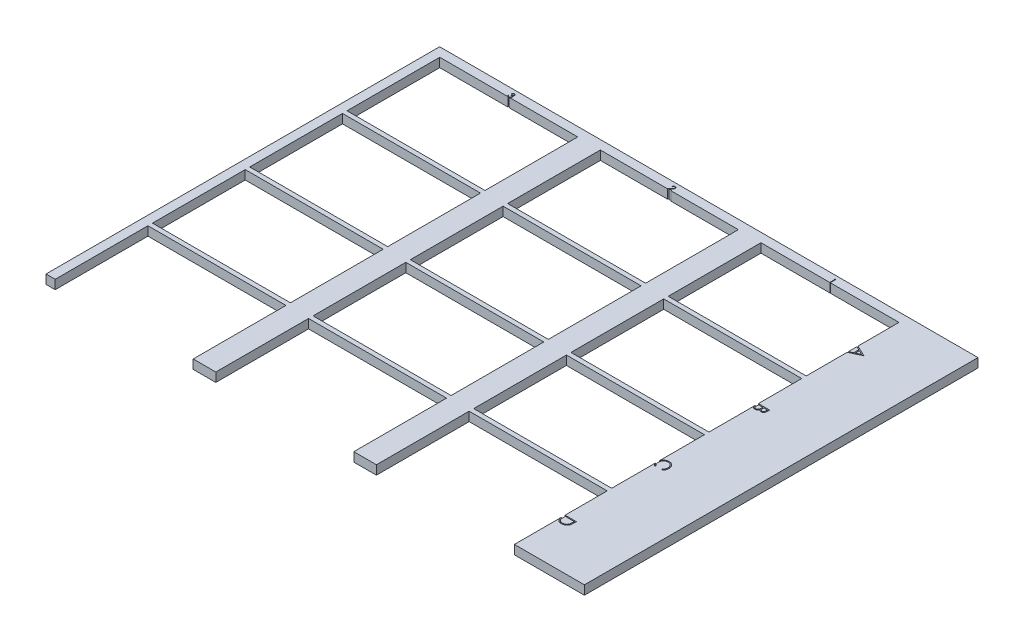
from build123d import *

# Parameters (mm, degrees)
SKETCH1_W           = 77.47
SKETCH1_H           = 52.07
BOSS_EXTRUDE4_DEPTH = 5.08
CUT_EXTRUDE9_DEPTH  = 5.08


with BuildPart() as part:
    # Sketch1 → Boss-Extrude4 (new body)
    with BuildSketch(Plane(origin=(0, 0, 0), x_dir=(1, 0, 0), z_dir=(0, 1, 0))):
        Polygon((-151.207591036, -110.49), (-146.05, -110.49), (-146.05, -58.42), (-68.58, -58.42), (-68.58, -110.49), (-55.88, -110.49), (-55.88, -58.42), (21.59, -58.42), (21.59, -110.49), (34.29, -110.49), (34.29, -58.42), (111.76, -58.42), (111.76, -110.49), (151.052408964, -110.49), (151.052408964, 110.49), (-151.207591036, 110.49), align=None)
        with Locations((-107.315, -29.845)):
            Rectangle(SKETCH1_W, SKETCH1_H, mode=Mode.SUBTRACT)
        with Locations((-17.145, -29.845)):
            Rectangle(SKETCH1_W, SKETCH1_H, mode=Mode.SUBTRACT)
        with Locations((73.025, -29.845)):
            Rectangle(SKETCH1_W, SKETCH1_H, mode=Mode.SUBTRACT)
        with Locations((-107.315, 24.765)):
            Rectangle(SKETCH1_W, SKETCH1_H, mode=Mode.SUBTRACT)
        with Locations((-17.145, 24.765)):
            Rectangle(SKETCH1_W, SKETCH1_H, mode=Mode.SUBTRACT)
        with Locations((-107.315, 79.375)):
            Rectangle(SKETCH1_W, SKETCH1_H, mode=Mode.SUBTRACT)
        with Locations((-17.145, 79.375)):
            Rectangle(SKETCH1_W, SKETCH1_H, mode=Mode.SUBTRACT)
        with Locations((73.025, 24.765)):
            Rectangle(SKETCH1_W, SKETCH1_H, mode=Mode.SUBTRACT)
        with Locations((73.025, 79.375)):
            Rectangle(SKETCH1_W, SKETCH1_H, mode=Mode.SUBTRACT)
    extrude(amount=BOSS_EXTRUDE4_DEPTH)

    # Sketch8 → Cut-Extrude9 (cut)
    # profile 1 of 7: a face of its own
    with BuildSketch(Plane(origin=(0, 5.08, 0), x_dir=(1, 0, 0), z_dir=(0, 1, 0))):
        Polygon((118.11, 79.293589744), (111.76, 76.362820513), (111.76, 76.982301683), (113.79525641, 77.921063702), (113.79525641, 80.799679487), (111.76, 81.765154247), (111.76, 82.387179487), (118.11, 79.375), align=None)
        Polygon((116.872309696, 79.340655048), (114.446538462, 80.49057492), (114.446538462, 78.221264022), align=None, mode=Mode.SUBTRACT)
    # profile 2 of 7: a face of its own
    with BuildSketch(Plane(origin=(0, 5.08, 0), x_dir=(1, 0, 0), z_dir=(0, 1, 0))):
        with BuildLine():
            Line((118.11, 26.474615385), (118.11, 25.235653045))
            add(Edge.make_bspline(
                [(118.11, 25.235653045), (118.109681139, 25.175004234), (118.109063106, 25.057451746), (118.099477996, 24.886510758), (118.086408481, 24.726402202), (118.065671027, 24.577079644), (118.040648803, 24.438612083), (118.010346937, 24.310582227), (117.974012938, 24.193397201), (117.916234684, 24.053492664), (117.830376936, 23.893979465), (117.703506539, 23.721262382), (117.548326213, 23.573571833), (117.37327911, 23.4462338), (117.180718496, 23.344994626), (116.975233967, 23.271753187), (116.75947595, 23.225383899), (116.611351899, 23.220615168), (116.536492388, 23.218205128)],
                knots=[0, 0, 0, 0, 1.001505555, 1.941167018, 2.826882275, 3.653841531, 4.429895133, 5.150066043, 5.825578002, 6.45369114, 7.647487171, 8.808567382, 9.977351308, 11.170798116, 12.373658725, 13.556498008, 14.765093433, 16, 16, 16, 16], degree=3))
            add(Edge.make_bspline(
                [(116.536492388, 23.218205128), (116.466353726, 23.220150205), (116.328524642, 23.223972465), (116.12725909, 23.261767034), (115.934882118, 23.318037757), (115.753765338, 23.399726219), (115.586236491, 23.504802861), (115.433291194, 23.631250472), (115.29863595, 23.781802882), (115.223670167, 23.894781468), (115.185590946, 23.952169471)],
                knots=[0, 0, 0, 0, 1.044266239, 2.052081639, 3.041743201, 4.026043445, 5.00270663, 5.980942822, 6.97441044, 8, 8, 8, 8], degree=3))
            add(Edge.make_bspline(
                [(115.185590946, 23.952169471), (115.157917248, 23.880020614), (115.10497061, 23.741981978), (115.010852235, 23.551885993), (114.90963819, 23.387448746), (114.798522364, 23.248489243), (114.677253559, 23.131437365), (114.548260115, 23.026322349), (114.405191505, 22.938259533), (114.252121508, 22.862606152), (114.090124446, 22.803067733), (113.919941192, 22.760940396), (113.743474705, 22.735055197), (113.623194862, 22.731525492), (113.562473958, 22.72974359)],
                knots=[0, 0, 0, 0, 1.272302504, 2.434229863, 3.488457646, 4.447234501, 5.35599188, 6.26022912, 7.18267843, 8.11661068, 9.06895546, 10.019249207, 11.000057067, 12, 12, 12, 12], degree=3))
            add(Edge.make_bspline(
                [(113.562473958, 22.72974359), (113.500485842, 22.731516424), (113.378522486, 22.735004524), (113.199347436, 22.7607231), (113.028142769, 22.804311677), (112.863691196, 22.864204763), (112.70692357, 22.942816916), (112.555876508, 23.036423505), (112.414573802, 23.150354586), (112.279655118, 23.277346904), (112.158418428, 23.421179366), (112.05048411, 23.576340817), (111.961311987, 23.745062992), (111.887341532, 23.924729456), (111.830014808, 24.116534097), (111.790215937, 24.31976575), (111.763336967, 24.53446858), (111.761131196, 24.681807332), (111.76, 24.757367788)],
                knots=[0, 0, 0, 0, 0.978404568, 1.925038397, 2.85041836, 3.763147166, 4.682162379, 5.614488577, 6.562659439, 7.54271123, 8.535210642, 9.526693784, 10.520907202, 11.541451354, 12.589717429, 13.675358278, 14.807842563, 16, 16, 16, 16], degree=3))
            Line((111.76, 24.757367788), (111.76, 26.474615385))
            Line((111.76, 26.474615385), (118.11, 26.474615385))
        make_face()
        with BuildLine():
            Line((117.458717949, 25.90474359), (115.423461538, 25.90474359))
            Line((115.423461538, 25.90474359), (115.423461538, 25.521860978))
            add(Edge.make_bspline(
                [(115.423461538, 25.521860978), (115.424181075, 25.465891945), (115.425571367, 25.357748368), (115.429679415, 25.200723225), (115.440678409, 25.055331233), (115.452311659, 24.921071395), (115.470224485, 24.798843581), (115.49214475, 24.688238604), (115.515124768, 24.588262886), (115.554315522, 24.473021329), (115.611648095, 24.342338932), (115.702715767, 24.203911992), (115.808237502, 24.079896012), (115.932241327, 23.976344233), (116.067626032, 23.890895914), (116.214403686, 23.833871415), (116.366844139, 23.793424687), (116.471770578, 23.789877771), (116.525044071, 23.788076923)],
                knots=[0, 0, 0, 0, 1.156481963, 2.23455883, 3.244418989, 4.168404366, 5.01828131, 5.794834307, 6.498111525, 7.13526334, 8.307595709, 9.435046769, 10.546766856, 11.659452936, 12.760769924, 13.837671619, 14.902137667, 16, 16, 16, 16], degree=3))
            add(Edge.make_bspline(
                [(116.525044071, 23.788076923), (116.56030457, 23.788977603), (116.629471889, 23.790744385), (116.729913527, 23.8068242), (116.82558773, 23.830156168), (116.914294057, 23.866607821), (116.998553798, 23.910685404), (117.074624411, 23.96802234), (117.1466735, 24.032775181), (117.212055599, 24.108821091), (117.270638216, 24.195791849), (117.322185781, 24.294516129), (117.362847974, 24.406172748), (117.399324126, 24.528230019), (117.4246346, 24.66264136), (117.445797527, 24.808093389), (117.456555228, 24.965820019), (117.457980962, 25.074940101), (117.458717949, 25.131346154)],
                knots=[0, 0, 0, 0, 0.911752476, 1.788502045, 2.626783689, 3.45400582, 4.26402138, 5.080402872, 5.911472738, 6.767166405, 7.66795952, 8.620018292, 9.640966946, 10.73819047, 11.913090943, 13.176185384, 14.540321519, 16, 16, 16, 16], degree=3))
            Line((117.458717949, 25.131346154), (117.458717949, 25.90474359))
        make_face(mode=Mode.SUBTRACT)
        with BuildLine():
            Line((114.772179487, 25.90474359), (112.411282051, 25.90474359))
            Line((112.411282051, 25.90474359), (112.411282051, 25.093185096))
            add(Edge.make_bspline(
                [(112.411282051, 25.093185096), (112.411975847, 25.035093328), (112.413313047, 24.923129104), (112.417726104, 24.761477849), (112.427553327, 24.612056238), (112.443574322, 24.47477829), (112.460221531, 24.348435585), (112.483262073, 24.23428334), (112.509456384, 24.132146551), (112.549993321, 24.013731405), (112.612860676, 23.880302727), (112.708268617, 23.736613475), (112.820435778, 23.607586425), (112.95189156, 23.499274679), (113.093745082, 23.409835086), (113.245254404, 23.347105881), (113.401797428, 23.306771901), (113.508807295, 23.302005692), (113.562473958, 23.299615385)],
                knots=[0, 0, 0, 0, 1.159821618, 2.235403267, 3.228114831, 4.14795534, 4.994323282, 5.771256229, 6.471395042, 7.097801288, 8.267864287, 9.404187171, 10.531774336, 11.667624178, 12.792825787, 13.866573821, 14.930062559, 16, 16, 16, 16], degree=3))
            add(Edge.make_bspline(
                [(113.562473958, 23.299615385), (113.596030503, 23.300103956), (113.662602321, 23.301073218), (113.760357737, 23.31624054), (113.855472736, 23.337399943), (113.946509043, 23.368040578), (114.034948011, 23.406675936), (114.119249173, 23.455161844), (114.2014282, 23.511153881), (114.305201688, 23.598743929), (114.42480707, 23.726024945), (114.541892162, 23.906931894), (114.636322991, 24.112618706), (114.676417579, 24.261803289), (114.697129407, 24.338868189)],
                knots=[0, 0, 0, 0, 0.723503378, 1.435336582, 2.130201219, 2.824764462, 3.504949994, 4.209866579, 4.920640069, 5.648298893, 7.13757748, 8.670694625, 10.280166878, 12, 12, 12, 12], degree=3))
            add(Edge.make_bspline(
                [(114.697129407, 24.338868189), (114.703398338, 24.369763806), (114.716990673, 24.436751875), (114.731329404, 24.545986183), (114.744191712, 24.671110852), (114.753456167, 24.811591078), (114.763401398, 24.967985569), (114.767131466, 25.140244081), (114.771684212, 25.328488394), (114.772010172, 25.459103286), (114.772179487, 25.526949119)],
                knots=[0, 0, 0, 0, 0.634452549, 1.375623993, 2.216454381, 3.166361212, 4.209414599, 5.370755378, 6.634280627, 8, 8, 8, 8], degree=3))
            Line((114.772179487, 25.526949119), (114.772179487, 25.90474359))
        make_face(mode=Mode.SUBTRACT)
    # profile 3 of 7: a face of its own
    with BuildSketch(Plane(origin=(0, 5.08, 0), x_dir=(1, 0, 0), z_dir=(0, 1, 0))):
        with BuildLine():
            Line((116.944815705, -32.938589744), (116.563205128, -32.439951923))
            add(Edge.make_bspline(
                [(116.563205128, -32.439951923), (116.605597673, -32.40438124), (116.689811221, -32.333719444), (116.808065537, -32.220037748), (116.918855368, -32.10156191), (117.022708493, -31.978337218), (117.115993196, -31.848145673), (117.203570769, -31.714141081), (117.282070808, -31.574081771), (117.377253654, -31.380403623), (117.476578821, -31.127042527), (117.559860398, -30.808100462), (117.612875959, -30.475158898), (117.618617886, -30.248014681), (117.621538462, -30.132479968)],
                knots=[0, 0, 0, 0, 0.757959112, 1.505699292, 2.245454638, 2.979532153, 3.711538275, 4.438200793, 5.171680507, 5.909471876, 7.393775596, 8.890124382, 10.418191784, 12, 12, 12, 12], degree=3))
            add(Edge.make_bspline(
                [(117.621538462, -30.132479968), (117.620802251, -30.068829613), (117.619336663, -29.942119638), (117.600137483, -29.754060275), (117.572842033, -29.56915638), (117.533326202, -29.388095544), (117.481880175, -29.211237272), (117.421547717, -29.037234935), (117.346470096, -28.868137816), (117.263556886, -28.701910874), (117.169880198, -28.542661658), (117.067735433, -28.391952614), (116.958125128, -28.250472259), (116.84133222, -28.117828549), (116.715905207, -27.995476207), (116.58331959, -27.881454356), (116.441979536, -27.777817938), (116.294535759, -27.682020268), (116.140771545, -27.596777475), (115.9816542, -27.523166197), (115.817792087, -27.46007521), (115.648849522, -27.409690045), (115.475491338, -27.369948117), (115.297349628, -27.342492588), (115.114770175, -27.323466123), (114.991019157, -27.322014016), (114.928639824, -27.321282051)],
                knots=[0, 0, 0, 0, 1.055000685, 2.100209969, 3.131349012, 4.153242145, 5.170189196, 6.184191144, 7.204341339, 8.235672124, 9.263040994, 10.265373269, 11.252624173, 12.22887325, 13.193405896, 14.155809299, 15.126090485, 16.097288279, 17.069732292, 18.038585918, 19.002221264, 19.978698174, 20.959418239, 21.948869816, 22.966084182, 24, 24, 24, 24], degree=3))
            add(Edge.make_bspline(
                [(114.928639824, -27.321282051), (114.834784429, -27.323571352), (114.650511811, -27.328066089), (114.380599417, -27.368068066), (114.122026195, -27.428855875), (113.876408481, -27.519961279), (113.640717603, -27.632300128), (113.418941397, -27.774250951), (113.207728487, -27.938655241), (113.012070568, -28.12783883), (112.833338524, -28.335403668), (112.675948183, -28.55810345), (112.544748325, -28.795383515), (112.435571964, -29.044623973), (112.351649044, -29.307742779), (112.29256842, -29.584266778), (112.254029036, -29.873594541), (112.250339344, -30.071296166), (112.248461538, -30.171913061)],
                knots=[0, 0, 0, 0, 1.029171465, 2.020641659, 2.987623507, 3.938342917, 4.889210282, 5.84687017, 6.821220943, 7.821438502, 8.827599549, 9.822697543, 10.807740252, 11.797342354, 12.80366471, 13.83203677, 14.896651826, 16, 16, 16, 16], degree=3))
            add(Edge.make_bspline(
                [(112.248461538, -30.171913061), (112.251525467, -30.282770797), (112.257556013, -30.50096534), (112.308644936, -30.820947331), (112.391481444, -31.127263648), (112.507410532, -31.41993077), (112.658114697, -31.698123628), (112.840809417, -31.962277569), (113.057232535, -32.212615561), (113.222483354, -32.363149173), (113.306794872, -32.439951923)],
                knots=[0, 0, 0, 0, 1.028121516, 2.023589091, 2.998037872, 3.967518031, 4.937445131, 5.927275754, 6.942489185, 8, 8, 8, 8], degree=3))
            Line((113.306794872, -32.439951923), (112.929000401, -32.938589744))
            add(Edge.make_bspline(
                [(112.929000401, -32.938589744), (112.877223407, -32.898461226), (112.773917427, -32.818396404), (112.628282924, -32.688750355), (112.491292127, -32.552178781), (112.36407883, -32.407649584), (112.243987323, -32.256891333), (112.135043577, -32.097248498), (112.033928993, -31.93147842), (111.942568033, -31.758615962), (111.860652906, -31.579228654), (111.791497891, -31.393503181), (111.731069307, -31.20301302), (111.681684053, -31.007662239), (111.643076564, -30.806798224), (111.617282312, -30.601110145), (111.599606535, -30.390163816), (111.597995761, -30.247848605), (111.597179487, -30.175729167)],
                knots=[0, 0, 0, 0, 0.986756325, 1.968786143, 2.935506311, 3.899499537, 4.868307269, 5.8376204, 6.809456583, 7.792545619, 8.781780509, 9.778496008, 10.776623214, 11.79151764, 12.812666265, 13.856269958, 14.913646641, 16, 16, 16, 16], degree=3))
            add(Edge.make_bspline(
                [(111.597179487, -30.175729167), (111.597654817, -30.107432799), (111.598594721, -29.97238519), (111.613820511, -29.772997455), (111.634593605, -29.578887787), (111.665872129, -29.390610966), (111.702782574, -29.207139554), (111.752260425, -29.030136779), (111.807685342, -28.857860898), (111.872827246, -28.691004051), (111.946335178, -28.52942431), (112.029414149, -28.373642823), (112.121365532, -28.223731239), (112.220162479, -28.07821569), (112.328978441, -27.939245788), (112.446302192, -27.805617249), (112.571738298, -27.676580756), (112.662189246, -27.596747314), (112.707666266, -27.556608574)],
                knots=[0, 0, 0, 0, 1.114604814, 2.203992996, 3.262667896, 4.300477797, 5.318619304, 6.316056647, 7.298880507, 8.271930387, 9.238335007, 10.195173496, 11.151986948, 12.108099108, 13.064862484, 14.031167946, 15.010108607, 16, 16, 16, 16], degree=3))
            add(Edge.make_bspline(
                [(112.707666266, -27.556608574), (112.786662423, -27.492318192), (112.943701026, -27.364513598), (113.198219878, -27.200999858), (113.463955057, -27.061032151), (113.742302642, -26.947864409), (114.032638045, -26.859394879), (114.335107621, -26.798106139), (114.649428887, -26.758279657), (114.86321849, -26.753725276), (114.971889022, -26.751410256)],
                knots=[0, 0, 0, 0, 0.994628077, 1.977248131, 2.950237994, 3.925870899, 4.908910175, 5.911660606, 6.938484602, 8, 8, 8, 8], degree=3))
            add(Edge.make_bspline(
                [(114.971889022, -26.751410256), (115.086103424, -26.754244442), (115.310813128, -26.759820525), (115.640671219, -26.806804203), (115.956243845, -26.883302707), (116.258745252, -26.988641657), (116.546444643, -27.127611896), (116.820557094, -27.295846609), (117.080858784, -27.494989044), (117.324021732, -27.72253816), (117.546337205, -27.97213776), (117.741930009, -28.239412742), (117.904702809, -28.523860895), (118.040767384, -28.82234304), (118.145350881, -29.137095699), (118.218563099, -29.467446937), (118.264132722, -29.812776116), (118.269893457, -30.048383659), (118.272820513, -30.168096955)],
                knots=[0, 0, 0, 0, 1.032901378, 2.032168977, 3.007206631, 3.966850309, 4.924221947, 5.891988639, 6.871730993, 7.884084801, 8.900290346, 9.89161143, 10.874607481, 11.860025555, 12.854717796, 13.869097222, 14.917278314, 16, 16, 16, 16], degree=3))
            add(Edge.make_bspline(
                [(118.272820513, -30.168096955), (118.27194643, -30.24105764), (118.270216271, -30.385475968), (118.253322795, -30.599110851), (118.225211517, -30.807112405), (118.186697164, -31.009983654), (118.139491479, -31.208460249), (118.077695589, -31.40050597), (118.005935411, -31.587166578), (117.925394904, -31.768581871), (117.833318651, -31.942778105), (117.733314188, -32.109723579), (117.623073079, -32.267404402), (117.506239897, -32.418786561), (117.378444314, -32.560461963), (117.243848093, -32.696476823), (117.098457292, -32.822132675), (116.996123317, -32.89969966), (116.944815705, -32.938589744)],
                knots=[0, 0, 0, 0, 1.096705196, 2.170817488, 3.219277236, 4.250701065, 5.274195539, 6.284202015, 7.28098643, 8.279664616, 9.266225751, 10.241373748, 11.203306326, 12.157093976, 13.114198862, 14.069774147, 15.032234603, 16, 16, 16, 16], degree=3))
        make_face()
    # profile 4 of 7: a face of its own
    with BuildSketch(Plane(origin=(0, 5.08, 0), x_dir=(1, 0, 0), z_dir=(0, 1, 0))):
        with BuildLine():
            Line((111.76, -82.012692308), (118.11, -82.012692308))
            Line((118.11, -82.012692308), (118.11, -83.294903846))
            add(Edge.make_bspline(
                [(118.11, -83.294903846), (118.10919924, -83.406426385), (118.107652175, -83.62188735), (118.097786915, -83.933238257), (118.080511466, -84.220906485), (118.054862343, -84.484728674), (118.024076207, -84.725128674), (117.984923928, -84.941721457), (117.938878197, -85.134858028), (117.899605318, -85.253638066), (117.881033654, -85.309807692)],
                knots=[0, 0, 0, 0, 1.314317071, 2.539253741, 3.67075822, 4.709970291, 5.662644612, 6.526156501, 7.303037452, 8, 8, 8, 8], degree=3))
            add(Edge.make_bspline(
                [(117.881033654, -85.309807692), (117.853037914, -85.383276673), (117.797681284, -85.528548601), (117.693258165, -85.735390771), (117.574941266, -85.930107124), (117.44258475, -86.11375686), (117.2924032, -86.282089414), (117.130916153, -86.441891296), (116.951524797, -86.585988874), (116.760320009, -86.720164865), (116.555362101, -86.837571052), (116.340810785, -86.941109671), (116.117067511, -87.029513574), (115.882503759, -87.098492965), (115.639371325, -87.15548169), (115.385829701, -87.193719768), (115.123356971, -87.219119775), (114.945238152, -87.221659883), (114.854861779, -87.222948718)],
                knots=[0, 0, 0, 0, 0.98467389, 1.947018643, 2.898343565, 3.837828625, 4.779009928, 5.722093987, 6.681368302, 7.658573986, 8.646467994, 9.637429229, 10.641859304, 11.657149908, 12.698561448, 13.768651538, 14.867827761, 16, 16, 16, 16], degree=3))
            add(Edge.make_bspline(
                [(114.854861779, -87.222948718), (114.776373797, -87.221806822), (114.621705032, -87.219556598), (114.39375275, -87.199375846), (114.172580583, -87.169987158), (113.959159893, -87.124695693), (113.752052982, -87.069043404), (113.552243376, -87.000351318), (113.359584615, -86.918944546), (113.175646042, -86.82449634), (113.000731948, -86.721221421), (112.837852299, -86.607986514), (112.683909336, -86.491289421), (112.545846691, -86.362132049), (112.415768103, -86.229414775), (112.300701958, -86.08609986), (112.195636064, -85.936856417), (112.101337325, -85.778809783), (112.019522725, -85.608171823), (111.94943361, -85.422613554), (111.891722261, -85.221141181), (111.843495333, -85.004063511), (111.805260876, -84.770955192), (111.779629867, -84.521602395), (111.762298604, -84.256383924), (111.760781079, -84.074267288), (111.76, -83.980530849)],
                knots=[0, 0, 0, 0, 1.105818345, 2.179130549, 3.222742436, 4.24813173, 5.251184997, 6.243232575, 7.223185975, 8.195898781, 9.155064964, 10.083206407, 10.990357329, 11.874224667, 12.744762365, 13.607037788, 14.46074101, 15.315384698, 16.197310979, 17.123950979, 18.107232398, 19.148086642, 20.256146639, 21.433991621, 22.679261309, 24, 24, 24, 24], degree=3))
            Line((111.76, -83.980530849), (111.76, -82.012692308))
        make_face()
        with BuildLine():
            Line((112.411282051, -82.582564103), (112.411282051, -83.311440304))
            add(Edge.make_bspline(
                [(112.411282051, -83.311440304), (112.411732169, -83.416176063), (112.41259791, -83.617621283), (112.420194693, -83.907286506), (112.432607922, -84.171953411), (112.449979849, -84.411659579), (112.472964337, -84.626269665), (112.498590946, -84.816232183), (112.53051775, -84.980924438), (112.559457347, -85.08058213), (112.572830529, -85.126634615)],
                knots=[0, 0, 0, 0, 1.375205317, 2.645023457, 3.804390687, 4.853969522, 5.800190428, 6.637939096, 7.370582563, 8, 8, 8, 8], degree=3))
            add(Edge.make_bspline(
                [(112.572830529, -85.126634615), (112.593242549, -85.184599298), (112.633579048, -85.299144178), (112.707184232, -85.464010709), (112.794265109, -85.61784952), (112.891632722, -85.763227177), (113.000795015, -85.899202305), (113.122082386, -86.02517169), (113.254153497, -86.142030641), (113.397503093, -86.248500834), (113.551204387, -86.34363756), (113.713300631, -86.426559757), (113.883400607, -86.496918019), (114.062117399, -86.554129451), (114.249282549, -86.598465023), (114.444403664, -86.63000926), (114.647541614, -86.649619319), (114.785702691, -86.651909464), (114.856133814, -86.653076923)],
                knots=[0, 0, 0, 0, 0.998463025, 1.973077781, 2.929496817, 3.867873318, 4.813809365, 5.759268434, 6.706333209, 7.676553387, 8.657505312, 9.640584699, 10.632319813, 11.645628493, 12.686877747, 13.755137172, 14.855624085, 16, 16, 16, 16], degree=3))
            add(Edge.make_bspline(
                [(114.856133814, -86.653076923), (114.930398398, -86.652144681), (115.07629183, -86.650313282), (115.290366967, -86.627332533), (115.49623045, -86.593678155), (115.694030492, -86.545268959), (115.88350975, -86.482728451), (116.065738702, -86.407893664), (116.238372234, -86.317032486), (116.402872487, -86.214168026), (116.556748208, -86.098683831), (116.698196661, -85.971092184), (116.827481331, -85.832738462), (116.94480806, -85.684260293), (117.048090353, -85.523581703), (117.139968669, -85.353421689), (117.218033951, -85.17138332), (117.259539698, -85.044720759), (117.280633013, -84.980350561)],
                knots=[0, 0, 0, 0, 1.122272916, 2.204715076, 3.251197285, 4.274229216, 5.279697671, 6.265416158, 7.248880903, 8.225321784, 9.195852973, 10.153576302, 11.101466393, 12.055578741, 13.010401466, 13.985536859, 14.976245305, 16, 16, 16, 16], degree=3))
            add(Edge.make_bspline(
                [(117.280633013, -84.980350561), (117.295358532, -84.927099195), (117.326669026, -84.813872182), (117.36082363, -84.629106297), (117.390948936, -84.421161669), (117.416454236, -84.189115068), (117.434755519, -83.933231006), (117.448492047, -83.653312687), (117.457756937, -83.349239119), (117.458389591, -83.138450807), (117.458717949, -83.029048478)],
                knots=[0, 0, 0, 0, 0.674548936, 1.434276114, 2.292660221, 3.240891867, 4.284742987, 5.42552168, 6.663806718, 8, 8, 8, 8], degree=3))
            Line((117.458717949, -83.029048478), (117.458717949, -82.582564103))
            Line((117.458717949, -82.582564103), (112.411282051, -82.582564103))
        make_face(mode=Mode.SUBTRACT)
    # profile 5 of 7: a face of its own
    with BuildSketch(Plane(origin=(0, 5.08, 0), x_dir=(1, 0, 0), z_dir=(0, 1, 0))):
        with BuildLine():
            Line((-108.006987179, 107.852307692), (-108.291923077, 107.852307692))
            add(Edge.make_bspline(
                [(-108.291923077, 107.852307692), (-108.284203699, 107.884268588), (-108.269112946, 107.946749526), (-108.23763729, 108.03601897), (-108.203347966, 108.120495307), (-108.162173564, 108.198596746), (-108.117262051, 108.271892893), (-108.065806439, 108.338721313), (-108.010180691, 108.400781646), (-107.948653773, 108.455857226), (-107.884129915, 108.50572988), (-107.815699939, 108.548252254), (-107.7447406, 108.584832021), (-107.670760258, 108.614967517), (-107.593538659, 108.637669242), (-107.513773929, 108.654140059), (-107.43125704, 108.664836284), (-107.375243154, 108.66588019), (-107.346800881, 108.666410256)],
                knots=[0, 0, 0, 0, 1.162005537, 2.271625781, 3.343758855, 4.383309926, 5.390229558, 6.379919256, 7.361854164, 8.333198761, 9.295911338, 10.242430842, 11.177959212, 12.116337295, 13.062827104, 14.020064771, 14.994644689, 16, 16, 16, 16], degree=3))
            add(Edge.make_bspline(
                [(-107.346800881, 108.666410256), (-107.305360108, 108.665159098), (-107.223382505, 108.662684071), (-107.102947456, 108.640083118), (-106.986808841, 108.604318891), (-106.876237881, 108.554903438), (-106.773532588, 108.493954947), (-106.682150476, 108.421415507), (-106.603330184, 108.338684712), (-106.53720457, 108.247305886), (-106.485429392, 108.14964696), (-106.447251039, 108.049135389), (-106.424008514, 107.9460096), (-106.420996295, 107.876379783), (-106.419487179, 107.841495393)],
                knots=[0, 0, 0, 0, 1.083050992, 2.142477498, 3.193116406, 4.255571735, 5.30263384, 6.308962982, 7.297363603, 8.282367274, 9.249857812, 10.179914175, 11.08814088, 12, 12, 12, 12], degree=3))
            add(Edge.make_bspline(
                [(-106.419487179, 107.841495393), (-106.420542723, 107.807924943), (-106.422608257, 107.742232783), (-106.44014669, 107.646328282), (-106.469661729, 107.555939116), (-106.510546442, 107.470684776), (-106.563470562, 107.391105814), (-106.627580795, 107.317023185), (-106.703329638, 107.248108306), (-106.760732674, 107.208629927), (-106.790285457, 107.188305288)],
                knots=[0, 0, 0, 0, 1.024540389, 2.004866551, 2.965041327, 3.920577974, 4.882998113, 5.874504559, 6.905732034, 8, 8, 8, 8], degree=3))
            add(Edge.make_bspline(
                [(-106.790285457, 107.188305288), (-106.756510937, 107.171996519), (-106.689593843, 107.139684128), (-106.598380149, 107.076314977), (-106.515578076, 107.003148148), (-106.469401131, 106.94605017), (-106.44619992, 106.917361779)],
                knots=[0, 0, 0, 0, 1.015518401, 2.012035669, 3.001164323, 4, 4, 4, 4], degree=3))
            add(Edge.make_bspline(
                [(-106.44619992, 106.917361779), (-106.430922416, 106.896445104), (-106.400617589, 106.85495428), (-106.363211069, 106.788246236), (-106.329275659, 106.720798814), (-106.302832245, 106.65080421), (-106.282354523, 106.57907369), (-106.267716837, 106.505484088), (-106.258623509, 106.429975311), (-106.257321258, 106.378891847), (-106.256666667, 106.353214143)],
                knots=[0, 0, 0, 0, 1.025084078, 2.033381695, 3.024893161, 4.013698104, 4.991890475, 5.976764909, 6.982997093, 8, 8, 8, 8], degree=3))
            add(Edge.make_bspline(
                [(-106.256666667, 106.353214143), (-106.258294547, 106.308755324), (-106.261542646, 106.220046911), (-106.290574914, 106.088987699), (-106.335581211, 105.960875994), (-106.399495717, 105.838343818), (-106.477389814, 105.723698758), (-106.570061101, 105.621122392), (-106.676456629, 105.532949372), (-106.795116039, 105.459280094), (-106.923673719, 105.400390265), (-107.061174435, 105.359516727), (-107.205636984, 105.332895713), (-107.304703604, 105.330041054), (-107.355069111, 105.328589744)],
                knots=[0, 0, 0, 0, 0.955779014, 1.907060117, 2.875433937, 3.871313158, 4.872415639, 5.851225146, 6.836215519, 7.83643374, 8.849228613, 9.86973379, 10.916971861, 12, 12, 12, 12], degree=3))
            add(Edge.make_bspline(
                [(-107.355069111, 105.328589744), (-107.389013762, 105.329377337), (-107.455805515, 105.330927058), (-107.553997832, 105.341521218), (-107.647725373, 105.36087058), (-107.737114866, 105.386908578), (-107.82224572, 105.419921087), (-107.902858158, 105.46103162), (-107.979448133, 105.509392769), (-108.051292896, 105.565575381), (-108.118383883, 105.628423453), (-108.17893814, 105.699052698), (-108.233965237, 105.776157486), (-108.281991774, 105.860633401), (-108.325205295, 105.951388741), (-108.36074802, 106.049585593), (-108.392031357, 106.154346099), (-108.406576, 106.227350906), (-108.414038462, 106.264807692)],
                knots=[0, 0, 0, 0, 1.048658725, 2.063410685, 3.046034179, 4.001477787, 4.936774919, 5.862367409, 6.792675028, 7.730719943, 8.675894397, 9.627829632, 10.600096036, 11.597688215, 12.626045268, 13.701542398, 14.82072376, 16, 16, 16, 16], degree=3))
            Line((-108.414038462, 106.264807692), (-108.129102564, 106.264807692))
            add(Edge.make_bspline(
                [(-108.129102564, 106.264807692), (-108.12167915, 106.240361087), (-108.107239964, 106.192810317), (-108.082661565, 106.124375183), (-108.054659633, 106.061638949), (-108.024619997, 106.004141403), (-107.993070978, 105.951316295), (-107.957769582, 105.904560456), (-107.921330429, 105.861820237), (-107.89386273, 105.837740482), (-107.880419671, 105.825955529)],
                knots=[0, 0, 0, 0, 1.198163088, 2.33053128, 3.407730985, 4.417276592, 5.372219308, 6.28897303, 7.162600585, 8, 8, 8, 8], degree=3))
            add(Edge.make_bspline(
                [(-107.880419671, 105.825955529), (-107.862642777, 105.812250112), (-107.827143861, 105.784881583), (-107.769296966, 105.749955106), (-107.708459534, 105.71969189), (-107.643313365, 105.696574537), (-107.575264252, 105.677000516), (-107.503212285, 105.664191188), (-107.427793138, 105.655402633), (-107.376296667, 105.654627088), (-107.34998097, 105.654230769)],
                knots=[0, 0, 0, 0, 0.946170439, 1.889420265, 2.845303464, 3.807233317, 4.801018734, 5.828864929, 6.890507805, 8, 8, 8, 8], degree=3))
            add(Edge.make_bspline(
                [(-107.34998097, 105.654230769), (-107.320268864, 105.654789483), (-107.262169405, 105.655882), (-107.177392497, 105.665929249), (-107.096740741, 105.680561838), (-107.021109587, 105.703161472), (-106.949508341, 105.731084102), (-106.882940702, 105.766143727), (-106.820532806, 105.807277867), (-106.763083988, 105.854031247), (-106.711426277, 105.905213603), (-106.665942576, 105.958746889), (-106.627275919, 106.014405392), (-106.596085101, 106.072497116), (-106.571455674, 106.132781502), (-106.55468877, 106.195427726), (-106.54303061, 106.259923103), (-106.542081183, 106.303764382), (-106.541602564, 106.325865385)],
                knots=[0, 0, 0, 0, 1.217147791, 2.380027433, 3.494444702, 4.572153297, 5.609568379, 6.639424714, 7.649109417, 8.668170816, 9.669597737, 10.625200337, 11.543417969, 12.441394052, 13.322311151, 14.205496177, 15.095365482, 16, 16, 16, 16], degree=3))
            add(Edge.make_bspline(
                [(-106.541602564, 106.325865385), (-106.542990766, 106.355448528), (-106.545760263, 106.414467612), (-106.566904474, 106.501297126), (-106.601683301, 106.584956936), (-106.650371936, 106.664019688), (-106.709640776, 106.737294971), (-106.778914656, 106.802674101), (-106.858768834, 106.856621969), (-106.93226543, 106.893895251), (-106.997366679, 106.919328883), (-107.053079206, 106.936269744), (-107.115451268, 106.950614988), (-107.183728599, 106.96396112), (-107.258425659, 106.975319772), (-107.339461128, 106.984791991), (-107.426851426, 106.992371206), (-107.487349841, 106.995755843), (-107.518525641, 106.9975)],
                knots=[0, 0, 0, 0, 1.07054697, 2.135767047, 3.216561865, 4.33974944, 5.486079747, 6.621378074, 7.775625952, 8.963672916, 9.598146892, 10.304877434, 11.070270905, 11.915000392, 12.823868403, 13.805723172, 14.86925407, 16, 16, 16, 16], degree=3))
            Line((-107.518525641, 106.9975), (-107.518525641, 107.323141026))
            add(Edge.make_bspline(
                [(-107.518525641, 107.323141026), (-107.479245298, 107.323807598), (-107.402304755, 107.325113248), (-107.289914921, 107.340904801), (-107.182442702, 107.36274937), (-107.082269872, 107.396209509), (-106.990967111, 107.435071778), (-106.911755757, 107.480294854), (-106.84574556, 107.530563948), (-106.793257302, 107.586654958), (-106.753770073, 107.64681218), (-106.724898621, 107.709510862), (-106.707844039, 107.775300546), (-106.705567413, 107.82019928), (-106.704423077, 107.842767428)],
                knots=[0, 0, 0, 0, 1.321986639, 2.589447074, 3.816329219, 5.01088745, 6.139805852, 7.153945165, 8.075214402, 8.924034688, 9.728124013, 10.488707548, 11.240355623, 12, 12, 12, 12], degree=3))
            add(Edge.make_bspline(
                [(-106.704423077, 107.842767428), (-106.704799007, 107.859347954), (-106.705546902, 107.892334124), (-106.714978718, 107.94052615), (-106.729151955, 107.987244866), (-106.748637138, 108.032291594), (-106.774717676, 108.075353913), (-106.80592882, 108.116798956), (-106.84309274, 108.156390099), (-106.885678967, 108.19329296), (-106.931409676, 108.228462197), (-106.981529114, 108.258319567), (-107.034526101, 108.283851159), (-107.090459309, 108.304905493), (-107.149510255, 108.320743562), (-107.211401489, 108.332115361), (-107.27625103, 108.339225234), (-107.320493959, 108.340248868), (-107.342984776, 108.340769231)],
                knots=[0, 0, 0, 0, 0.884392785, 1.759457502, 2.611959086, 3.489218968, 4.37281399, 5.2945488, 6.255912374, 7.266815255, 8.301784654, 9.332968512, 10.37626691, 11.440494194, 12.520033166, 13.637162961, 14.798855837, 16, 16, 16, 16], degree=3))
            add(Edge.make_bspline(
                [(-107.342984776, 108.340769231), (-107.379135932, 108.339507067), (-107.449747547, 108.337041767), (-107.551542508, 108.315449033), (-107.646175046, 108.280997486), (-107.718509408, 108.239873961), (-107.771924315, 108.199278925), (-107.810094109, 108.163825617), (-107.847577715, 108.124425841), (-107.88190915, 108.078652887), (-107.916629115, 108.029606584), (-107.94823811, 107.974793673), (-107.978953688, 107.915643972), (-107.997461715, 107.873828647), (-108.006987179, 107.852307692)],
                knots=[0, 0, 0, 0, 1.472543308, 2.876219568, 4.221790263, 5.565193594, 6.249813518, 6.953379497, 7.687249741, 8.463570142, 9.283606569, 10.136032583, 11.040678096, 12, 12, 12, 12], degree=3))
        make_face()
    # profile 6 of 7: a face of its own
    with BuildSketch(Plane(origin=(0, 5.08, 0), x_dir=(1, 0, 0), z_dir=(0, 1, 0))):
        with BuildLine():
            Line((-17.836987179, 107.608076923), (-18.121923077, 107.608076923))
            add(Edge.make_bspline(
                [(-18.121923077, 107.608076923), (-18.120066017, 107.645878371), (-18.1164188, 107.720119409), (-18.099338852, 107.828363239), (-18.074899627, 107.931827235), (-18.040345237, 108.029680657), (-17.997431685, 108.122788718), (-17.945969446, 108.210781589), (-17.885015024, 108.293323596), (-17.81588463, 108.369649547), (-17.74080165, 108.4396697), (-17.659788405, 108.500135528), (-17.574657559, 108.551223701), (-17.48566739, 108.593933113), (-17.391813879, 108.625991402), (-17.293948715, 108.649778175), (-17.191641927, 108.664089574), (-17.12193705, 108.665627894), (-17.086486378, 108.666410256)],
                knots=[0, 0, 0, 0, 1.10065271, 2.161652631, 3.183658789, 4.190468796, 5.17591951, 6.163126047, 7.15150782, 8.156236427, 9.156009102, 10.134482811, 11.092018607, 12.041330605, 13.001268258, 13.972401359, 14.968799086, 16, 16, 16, 16], degree=3))
            add(Edge.make_bspline(
                [(-17.086486378, 108.666410256), (-17.051671982, 108.665595228), (-16.983262938, 108.663993726), (-16.883420968, 108.650240507), (-16.788372994, 108.628699863), (-16.698304806, 108.598478021), (-16.613935018, 108.557852148), (-16.534629828, 108.509050095), (-16.459445093, 108.452607819), (-16.391766082, 108.386156146), (-16.329619467, 108.315215411), (-16.276005278, 108.239479956), (-16.230091909, 108.161257675), (-16.191821656, 108.079952092), (-16.163649302, 107.994797659), (-16.142260499, 107.907034125), (-16.13017063, 107.815753047), (-16.128315139, 107.753970671), (-16.127371795, 107.722560096)],
                knots=[0, 0, 0, 0, 1.111607364, 2.184268762, 3.212621178, 4.221274766, 5.211760367, 6.196651075, 7.1921475, 8.207485113, 9.220403448, 10.201281604, 11.166441695, 12.114753415, 13.065576456, 14.026450734, 14.996634279, 16, 16, 16, 16], degree=3))
            add(Edge.make_bspline(
                [(-16.127371795, 107.722560096), (-16.128907826, 107.678338846), (-16.131952934, 107.590672367), (-16.158000975, 107.461844598), (-16.198683167, 107.337027711), (-16.247666484, 107.236573158), (-16.297080773, 107.155625632), (-16.341610154, 107.088979021), (-16.393738947, 107.01721906), (-16.45422587, 106.940586047), (-16.52181969, 106.858479726), (-16.597132653, 106.770949697), (-16.680701811, 106.678900306), (-16.739356308, 106.616030225), (-16.769749599, 106.583452524)],
                knots=[0, 0, 0, 0, 1.184426356, 2.348067706, 3.509069118, 4.696110526, 5.333549288, 6.050745305, 6.844228056, 7.710549037, 8.667450064, 9.695053472, 10.805634456, 12, 12, 12, 12], degree=3))
            Line((-16.769749599, 106.583452524), (-17.564135617, 105.735641026))
            Line((-17.564135617, 105.735641026), (-16.086666667, 105.735641026))
            Line((-16.086666667, 105.735641026), (-16.086666667, 105.41))
            Line((-16.086666667, 105.41), (-18.244038462, 105.41))
            Line((-18.244038462, 105.41), (-17.012708333, 106.72401242))
            add(Edge.make_bspline(
                [(-17.012708333, 106.72401242), (-16.982729179, 106.755307312), (-16.925145359, 106.815418396), (-16.843699735, 106.903178081), (-16.770548653, 106.984593736), (-16.70521859, 107.059511533), (-16.649126767, 107.129027313), (-16.599349814, 107.190889651), (-16.559466742, 107.247816902), (-16.516182061, 107.313803031), (-16.474259378, 107.39436849), (-16.438234598, 107.492824051), (-16.416268271, 107.59417663), (-16.413633171, 107.662667764), (-16.412307692, 107.697119391)],
                knots=[0, 0, 0, 0, 1.329631726, 2.553950428, 3.673215718, 4.687767853, 5.603093632, 6.413772471, 7.123043292, 7.734684054, 8.834405432, 9.900288307, 10.943827018, 12, 12, 12, 12], degree=3))
            add(Edge.make_bspline(
                [(-16.412307692, 107.697119391), (-16.412884401, 107.718783231), (-16.414020984, 107.7614785), (-16.424051896, 107.824076581), (-16.439210712, 107.884460376), (-16.460932482, 107.942815624), (-16.48960431, 107.998555608), (-16.524505162, 108.051748179), (-16.564773291, 108.103173169), (-16.611356228, 108.151390804), (-16.662529535, 108.195551612), (-16.716590033, 108.234671318), (-16.773785485, 108.26736394), (-16.833874739, 108.294164112), (-16.896690271, 108.315187494), (-16.962353576, 108.329754919), (-17.030683219, 108.338901173), (-17.077340748, 108.340138671), (-17.101114784, 108.340769231)],
                knots=[0, 0, 0, 0, 0.991446411, 1.95395049, 2.89581595, 3.838931463, 4.798493298, 5.75982156, 6.748411868, 7.785213223, 8.824556874, 9.840280684, 10.836137867, 11.835679398, 12.848801643, 13.863922112, 14.911575587, 16, 16, 16, 16], degree=3))
            add(Edge.make_bspline(
                [(-17.101114784, 108.340769231), (-17.125944039, 108.340120594), (-17.174704597, 108.33884678), (-17.246295434, 108.32993622), (-17.314590389, 108.314563922), (-17.379761259, 108.293539367), (-17.441918311, 108.266816255), (-17.500759266, 108.233531601), (-17.556152029, 108.193813718), (-17.608200733, 108.148782642), (-17.656155914, 108.098647032), (-17.698289865, 108.042757994), (-17.735105364, 107.982135982), (-17.767226597, 107.916944568), (-17.793312116, 107.846592211), (-17.813244903, 107.77132865), (-17.829017256, 107.691480682), (-17.834286414, 107.636339927), (-17.836987179, 107.608076923)],
                knots=[0, 0, 0, 0, 1.031018746, 2.02475058, 2.990194455, 3.934040569, 4.864654155, 5.795059489, 6.735614925, 7.690564532, 8.649604399, 9.611025574, 10.590972636, 11.591080095, 12.624614302, 13.701020113, 14.821632451, 16, 16, 16, 16], degree=3))
        make_face()
    # profile 7 of 7: a face of its own
    with BuildSketch(Plane(origin=(0, 5.08, 0), x_dir=(1, 0, 0), z_dir=(0, 1, 0))):
        Polygon((72.600776242, 108.585), (73.187820513, 108.585), (73.187820513, 105.41), (72.902884615, 105.41), (72.902884615, 108.259358974), (72.414423077, 108.259358974), align=None)
    extrude(amount=-CUT_EXTRUDE9_DEPTH, mode=Mode.SUBTRACT)


with BuildPart() as cut_extrude9_piece_1:
    # of the separate pieces the step leaves, piece 1, a body of its own (cut_extrude9_pieces)
    add(part.part.solids().sort_by_distance((151.052408964, 0, -110.49))[0])


with BuildPart() as cut_extrude9_piece_2:
    # of the separate pieces the step leaves, piece 2, a body of its own (cut_extrude9_pieces)
    add(part.part.solids().sort_by_distance((117.458717949, 0, 82.582564103))[0])


with BuildPart() as cut_extrude9_piece_3:
    # of the separate pieces the step leaves, piece 3, a body of its own (cut_extrude9_pieces)
    add(part.part.solids().sort_by_distance((111.76, 0, -81.765154247))[0])


with BuildPart() as cut_extrude9_piece_4:
    # of the separate pieces the step leaves, piece 4, a body of its own (cut_extrude9_pieces)
    add(part.part.solids().sort_by_distance((114.772179487, 0, -25.526949119))[0])


with BuildPart() as cut_extrude9_piece_5:
    # of the separate pieces the step leaves, piece 5, a body of its own (cut_extrude9_pieces)
    add(part.part.solids().sort_by_distance((117.458717949, 0, -25.131346154))[0])


with BuildPart() as cut_extrude9_piece_6:
    # of the separate pieces the step leaves, piece 6, a body of its own (cut_extrude9_pieces)
    add(part.part.solids().sort_by_distance((114.446538462, 0, -78.221264022))[0])


solid = Compound([cut_extrude9_piece_1.part, cut_extrude9_piece_2.part, cut_extrude9_piece_3.part, cut_extrude9_piece_4.part, cut_extrude9_piece_5.part, cut_extrude9_piece_6.part])
